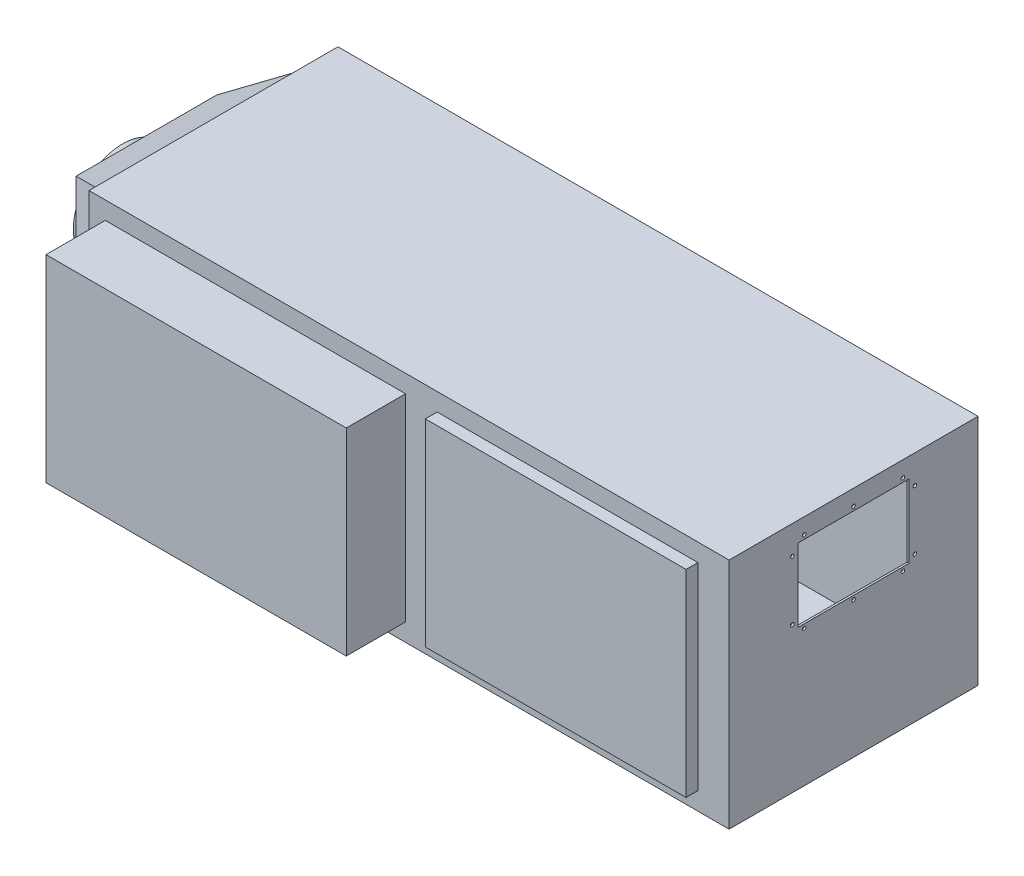
from build123d import *

# Parameters (mm, degrees)
SKETCH1_W           = 1620
SKETCH1_H           = 630
BOSS_EXTRUDE1_DEPTH = 590
SKETCH2_W           = 760
SKETCH2_H           = 500
BOSS_EXTRUDE2_DEPTH = 150
SKETCH3_W           = 560
SKETCH3_H           = 550
BOSS_EXTRUDE3_DEPTH = 170
BOSS_EXTRUDE3_TAPER = 31
SKETCH4_R           = 125
BOSS_EXTRUDE4_DEPTH = 60
SKETCH5_W           = 660
SKETCH5_H           = 500
BOSS_EXTRUDE5_DEPTH = 30
SHELL1_T            = -5
SKETCH7_R           = 4.5
SKETCH7_W           = 280
SKETCH7_H           = 185
CUT_EXTRUDE1_DEPTH  = 10
SCALE1_SCALE        = 0.1


with BuildPart() as part:
    # Sketch1 → Boss-Extrude1 (new body)
    with BuildSketch(Plane(origin=(0, 0, 0), x_dir=(1, 0, 0), z_dir=(0, 1, 0))):
        Rectangle(SKETCH1_W, SKETCH1_H)
    extrude(amount=BOSS_EXTRUDE1_DEPTH)

    # Sketch3 → Boss-Extrude3 (add)
    with BuildSketch(Plane.ZY.offset(810)):
        with Locations((0, 295)):
            Rectangle(SKETCH3_W, SKETCH3_H)
    extrude(amount=BOSS_EXTRUDE3_DEPTH, taper=BOSS_EXTRUDE3_TAPER)

    # Sketch4 → Boss-Extrude4 (add)
    with BuildSketch(Plane.ZY.offset(980)):
        with Locations(Location((0, 295, 0), (0, 0, 180))):
            Circle(SKETCH4_R)
    extrude(amount=BOSS_EXTRUDE4_DEPTH)

    # Sketch5 → Boss-Extrude5 (add)
    with BuildSketch(Plane.XY.offset(315)):
        with Locations((401.07364471, 295)):
            Rectangle(SKETCH5_W, SKETCH5_H)
    extrude(amount=BOSS_EXTRUDE5_DEPTH)

    # Shell1
    shell1_openings = [part.faces().sort_by_distance(p)[0] for p in [
        (-1040, 295, 0),
    ]]
    offset(amount=SHELL1_T, openings=shell1_openings, kind=Kind.INTERSECTION)

    # Sketch7 → Cut-Extrude1 (cut)
    with BuildSketch(Plane(origin=(810, 0, 0), x_dir=(0, 0, -1), z_dir=(1, 0, 0))):
        with Locations((-125, 550.17844245)):
            Circle(SKETCH7_R)
        with Locations((0, 550.17844245)):
            Circle(SKETCH7_R)
        with Locations((125, 550.17844245)):
            Circle(SKETCH7_R)
        with Locations((0, 345.17844245)):
            Circle(SKETCH7_R)
        with Locations((125, 345.17844245)):
            Circle(SKETCH7_R)
        with Locations((-125, 345.17844245)):
            Circle(SKETCH7_R)
        with Locations((-155, 518.17844245)):
            Circle(SKETCH7_R)
        with Locations((155, 518.17844245)):
            Circle(SKETCH7_R)
        with Locations((155, 368.17844245)):
            Circle(SKETCH7_R)
        with Locations((-155, 368.17844245)):
            Circle(SKETCH7_R)
        with Locations((0, 447.67844245)):
            Rectangle(SKETCH7_W, SKETCH7_H)
    extrude(amount=-CUT_EXTRUDE1_DEPTH, mode=Mode.SUBTRACT)


with BuildPart() as body_2:
    # Sketch2 → Boss-Extrude2 (new body)
    with BuildSketch(Plane.XY.offset(315)):
        with Locations((-388.92635529, 295)):
            Rectangle(SKETCH2_W, SKETCH2_H)
    extrude(amount=BOSS_EXTRUDE2_DEPTH)


with BuildPart() as body_2_1:
    # Scale1: scaled about (0, 0, 0)
    add(body_2.part.scale(SCALE1_SCALE))


with BuildPart() as part_1:
    # Scale1: scaled about (0, 0, 0)
    add(part.part.scale(SCALE1_SCALE))


solid = Compound([body_2_1.part, part_1.part])
